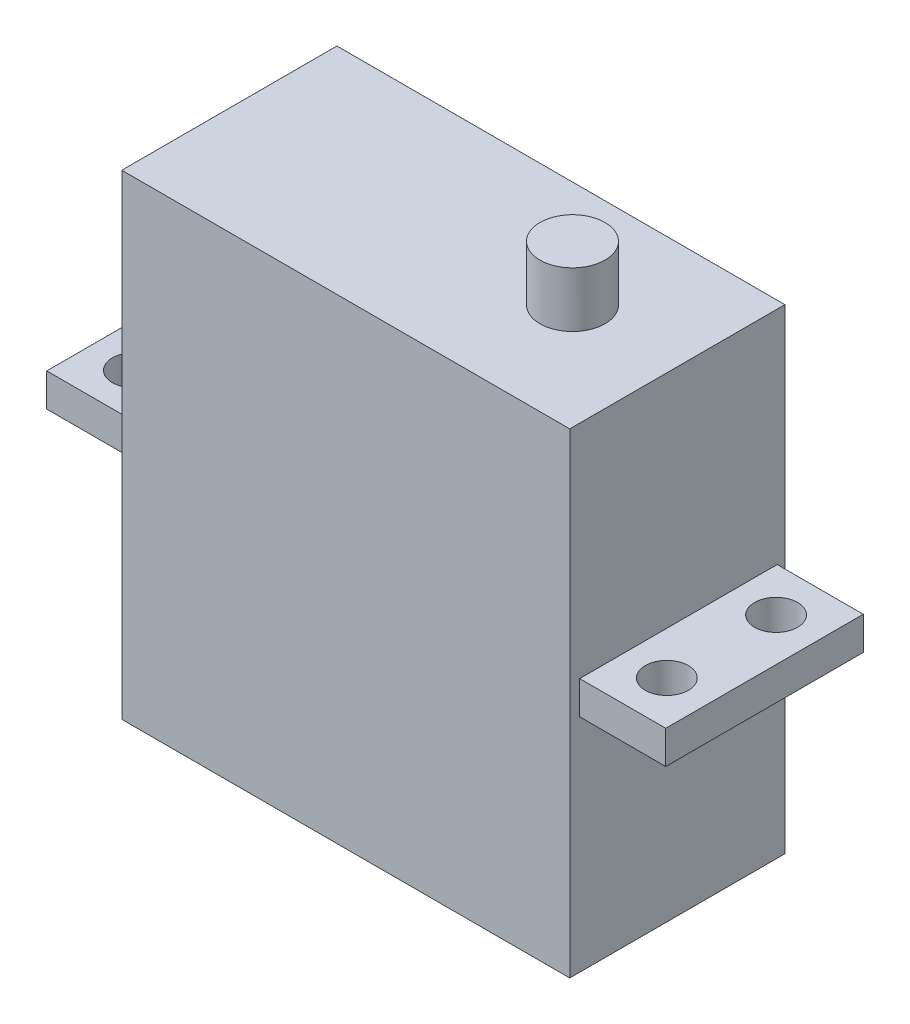
from build123d import *

# Parameters (mm, degrees)
CROQUIS1_W              = 40.6
CROQUIS1_H              = 19.5
EXTRUIR1_DEPTH          = 21.55
CROQUIS2_R              = 2.95
EXTRUIR2_DEPTH          = 5
CROQUIS4_W              = 7.8
CROQUIS4_H              = 17.9
CROQUIS4_R              = 1.95
SALIENTE_EXTRUIR1_DEPTH = 1.5


with BuildPart() as part:
    # Croquis1 → Extruir1 (new, symmetric)
    with BuildSketch(Plane(origin=(0, 0, 0), x_dir=(1, 0, 0), z_dir=(0, 1, 0))):
        with Locations((-0.05, -0.1)):
            Rectangle(CROQUIS1_W, CROQUIS1_H)
    extrude(amount=EXTRUIR1_DEPTH, both=True)

    # Croquis2 → Extruir2 (add)
    with BuildSketch(Plane(origin=(0, 21.55, 0), x_dir=(1, 0, 0), z_dir=(0, 1, 0))):
        with Locations(Location((10.650489708, -0.00303525, 0), (0, 0, 90))):
            Circle(CROQUIS2_R)
    extrude(amount=EXTRUIR2_DEPTH)

    # Croquis4 → Saliente-Extruir1 (add, symmetric)
    # profile 1 of 2: a face of its own
    with BuildSketch(Plane(origin=(0, 0, 0), x_dir=(-1, 0, 0), z_dir=(0, 1, 0))):
        with Locations((-24.15, 0)):
            Rectangle(CROQUIS4_W, CROQUIS4_H)
        with Locations(Location((-24.15, -4.95, 0), (0, 0, 90))):
            Circle(CROQUIS4_R, mode=Mode.SUBTRACT)
        with Locations(Location((-24.15, 4.95, 0), (0, 0, 270))):
            Circle(CROQUIS4_R, mode=Mode.SUBTRACT)
    # profile 2 of 2: a face of its own
    with BuildSketch(Plane(origin=(0, 0, 0), x_dir=(-1, 0, 0), z_dir=(0, 1, 0))):
        with Locations((24.15, 0)):
            Rectangle(CROQUIS4_W, CROQUIS4_H)
        with Locations(Location((24.15, -4.95, 0), (0, 0, 270))):
            Circle(CROQUIS4_R, mode=Mode.SUBTRACT)
        with Locations(Location((24.15, 4.95, 0), (0, 0, 90))):
            Circle(CROQUIS4_R, mode=Mode.SUBTRACT)
    extrude(amount=SALIENTE_EXTRUIR1_DEPTH, both=True)


solid = part.part
